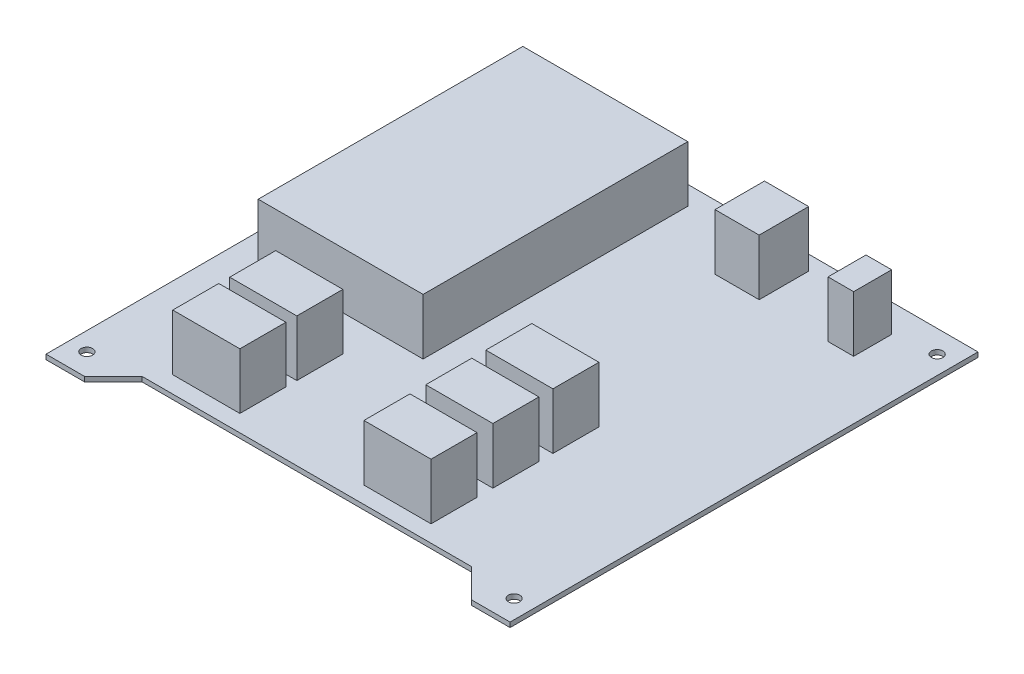
from build123d import *

# Parameters (mm, degrees)
SKETCH1_R           = 1.905
BOSS_EXTRUDE1_DEPTH = 1.5875
SKETCH2_W           = 22.225
SKETCH2_H           = 15.24
SKETCH2_W_2         = 14.620181031
SKETCH2_H_2         = 16.374602754
SKETCH2_W_3         = 54.61
SKETCH2_H_3         = 87.63
SKETCH2_W_4         = 8.479704998
SKETCH2_H_4         = 12.573355687
BOSS_EXTRUDE2_DEPTH = 18.542


with BuildPart() as part:
    # Sketch1 → Boss-Extrude1 (new body)
    with BuildSketch(Plane(origin=(0, 0, 0), x_dir=(1, 0, 0), z_dir=(0, 1, 0))):
        Polygon((-76.835, 77.47), (76.835, 77.47), (76.835, -77.47), (64.135, -77.47), (54.61, -67.945), (-54.61, -67.945), (-64.135, -77.47), (-76.835, -77.47), align=None)
        with Locations(Location((-70.739, 70.0405, 0), (0, 0, 270))):
            Circle(SKETCH1_R, mode=Mode.SUBTRACT)
        with Locations(Location((-70.739, -70.0405, 0), (0, 0, 270))):
            Circle(SKETCH1_R, mode=Mode.SUBTRACT)
        with Locations(Location((70.739, -70.0405, 0), (0, 0, 270))):
            Circle(SKETCH1_R, mode=Mode.SUBTRACT)
        with Locations(Location((70.739, 70.0405, 0), (0, 0, 270))):
            Circle(SKETCH1_R, mode=Mode.SUBTRACT)
    extrude(amount=BOSS_EXTRUDE1_DEPTH)

    # Sketch2 → Boss-Extrude2 (add)
    with BuildSketch(Plane(origin=(0, 1.5875, 0), x_dir=(1, 0, 0), z_dir=(0, 1, 0))):
        with Locations((-38.837784726, -54.764880682)):
            Rectangle(SKETCH2_W, SKETCH2_H)
        with Locations((-38.837784726, -35.904847152)):
            Rectangle(SKETCH2_W, SKETCH2_H)
        with Locations((24.469923971, -54.764880682)):
            Rectangle(SKETCH2_W, SKETCH2_H)
        with Locations((24.469923971, -34.296627238)):
            Rectangle(SKETCH2_W, SKETCH2_H)
        with Locations((24.469923971, -14.413181036)):
            Rectangle(SKETCH2_W, SKETCH2_H)
        with Locations((18.328285521, 64.38959472)):
            Rectangle(SKETCH2_W_2, SKETCH2_H_2)
        with Locations((-40.291302772, 27.368792631)):
            Rectangle(SKETCH2_W_3, SKETCH2_H_3)
        with Locations((53.270518185, 61.904163944)):
            Rectangle(SKETCH2_W_4, SKETCH2_H_4)
    extrude(amount=BOSS_EXTRUDE2_DEPTH)


solid = part.part
